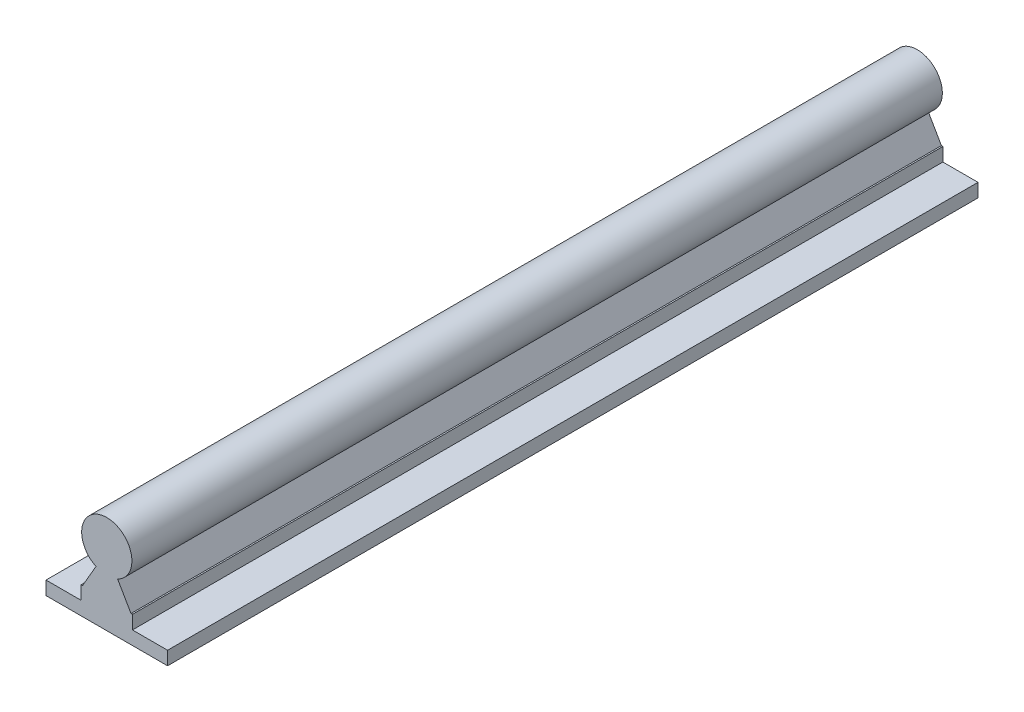
from build123d import *

# Parameters (mm, degrees)
EXTRUSION1_DEPTH = 300


with BuildPart() as part:
    # Sketch1 → Extrusion1 (new body)
    with BuildSketch(Plane.XY):
        with BuildLine():
            Line((-22.5, 0), (22.5, 0))
            Line((22.5, 0), (22.5, 5))
            Line((22.5, 5), (9.5, 5))
            Line((9.5, 5), (9.5, 10))
            Line((9.5, 10), (8.967618538, 10))
            Line((8.967618538, 10), (4, 18.604167701))
            ThreePointArc((4, 18.604167701), (0, 36.3), (-4, 18.604167701))
            Line((-4, 18.604167701), (-8.967618538, 10))
            Line((-8.967618538, 10), (-9.5, 10))
            Line((-9.5, 10), (-9.5, 5))
            Line((-9.5, 5), (-22.5, 5))
            Line((-22.5, 5), (-22.5, 0))
        make_face()
    extrude(amount=EXTRUSION1_DEPTH)


solid = part.part
